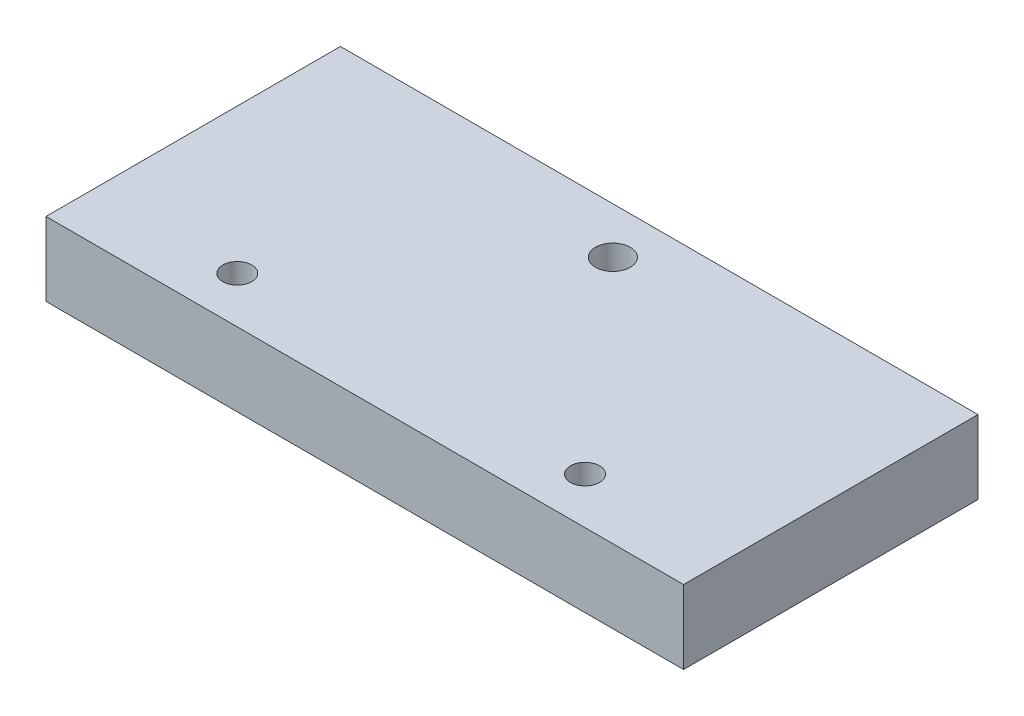
from build123d import *

# Parameters (mm, degrees)
CROQUIS1_W              = 110
CROQUIS1_H              = 50.8
SALIENTE_EXTRUIR1_DEPTH = 12.7
CROQUIS3_R              = 2.5
CROQUIS3_R_2            = 3
CORTAR_EXTRUIR1_DEPTH   = 12.7


with BuildPart() as part:
    # Croquis1 → Saliente-Extruir1 (new body)
    with BuildSketch(Plane(origin=(0, 0, 0), x_dir=(1, 0, 0), z_dir=(0, 1, 0))):
        Rectangle(CROQUIS1_W, CROQUIS1_H)
    extrude(amount=SALIENTE_EXTRUIR1_DEPTH)

    # Croquis3 → Cortar-Extruir1 (cut)
    with BuildSketch(Plane(origin=(0, 12.7, 0), x_dir=(1, 0, 0), z_dir=(0, 1, 0))):
        with Locations(Location((-30, -17.4, 0), (0, 0, 270))):
            Circle(CROQUIS3_R)
        with Locations(Location((30, -17.4, 0), (0, 0, 270))):
            Circle(CROQUIS3_R)
        with Locations(Location((0, 17.4, 0), (0, 0, 270))):
            Circle(CROQUIS3_R_2)
    extrude(amount=-CORTAR_EXTRUIR1_DEPTH, mode=Mode.SUBTRACT)


solid = part.part
